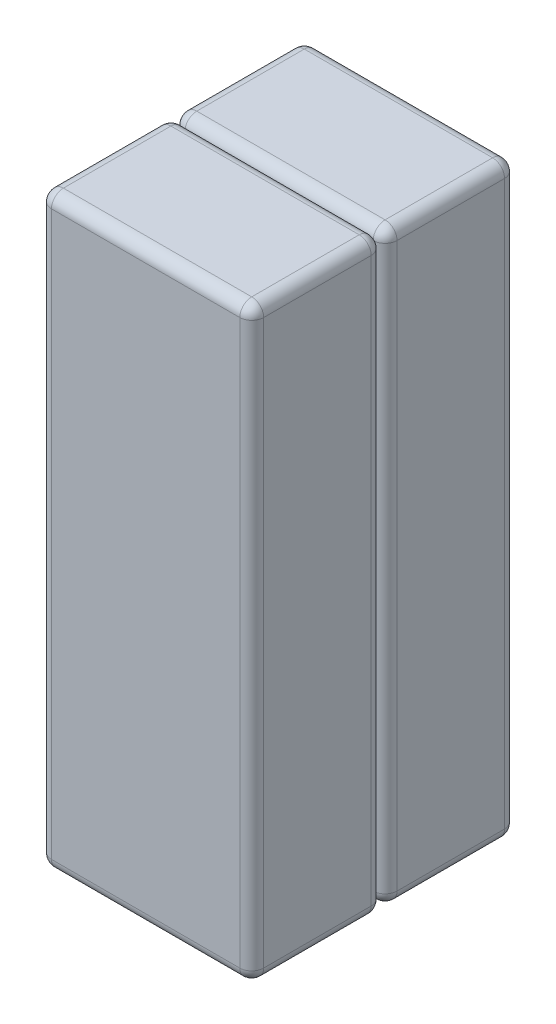
from build123d import *

# Parameters (mm, degrees)
SKETCH1_W           = 53.3
SKETCH1_H           = 147.5
BOSS_EXTRUDE1_DEPTH = 33
FILLET2_R           = 3
LPATTERN3_COUNT     = 2
LPATTERN3_PITCH     = 33.5


with BuildPart() as part:
    # Sketch1 → Boss-Extrude1 (new body)
    with BuildSketch(Plane.XY):
        with Locations((0, 131.792841013)):
            Rectangle(SKETCH1_W, SKETCH1_H)
    extrude(amount=BOSS_EXTRUDE1_DEPTH)

    # Fillet2
    fillet2_edges = [part.edges().sort_by_distance(p)[0] for p in [
        (26.65, 131.792841013, 33),
        (0, 205.542841013, 33),
        (-26.65, 131.792841013, 33),
        (0, 205.542841013, 0),
        (26.65, 131.792841013, 0),
        (0, 58.042841013, 0),
        (-26.65, 131.792841013, 0),
        (0, 58.042841013, 33),
        (-26.65, 205.542841013, 16.5),
        (26.65, 205.542841013, 16.5),
        (26.65, 58.042841013, 16.5),
        (-26.65, 58.042841013, 16.5),
    ]]
    fillet(fillet2_edges, radius=FILLET2_R)


with BuildPart() as lpattern3_1:
    # LPattern3: pattern copy
    add(part.part.moved(Location(Vector(0, 0, -1) * (1 * LPATTERN3_PITCH))))


solid = Compound([part.part, lpattern3_1.part])
